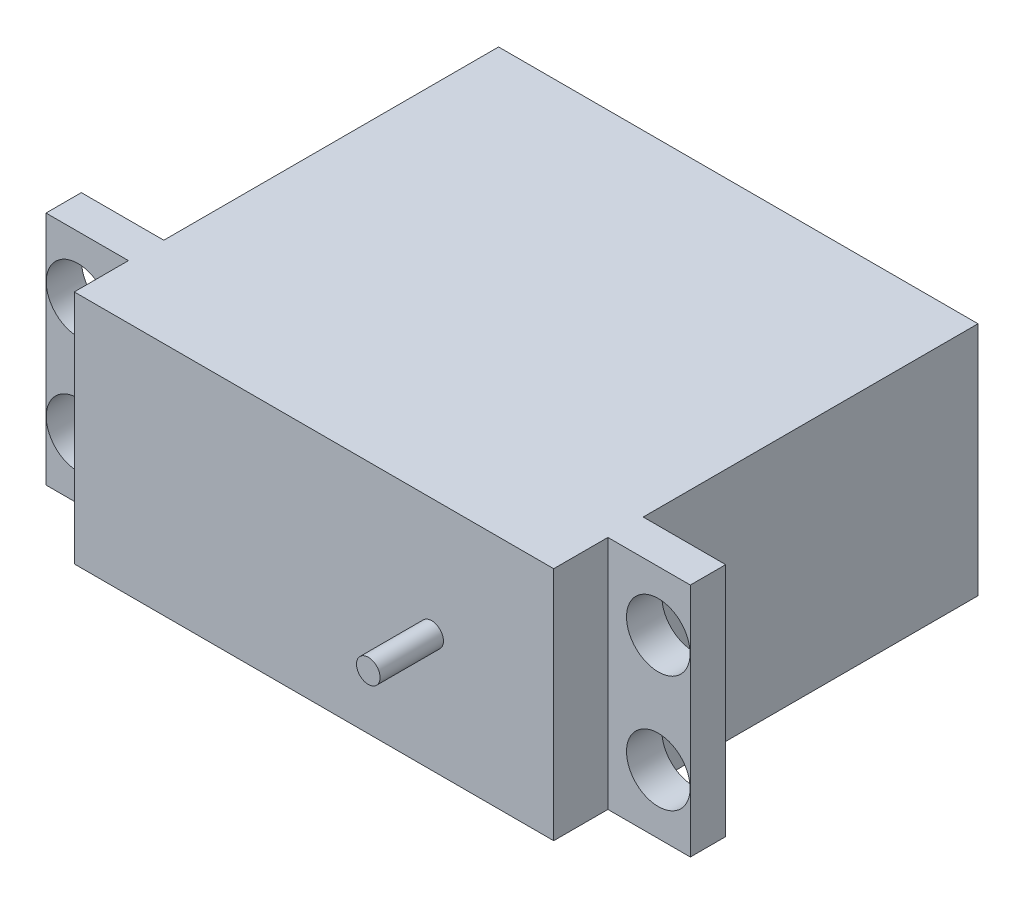
from build123d import *

# Parameters (mm, degrees)
SKETCH1_W           = 40.7
SKETCH1_H           = 20
BOSS_EXTRUDE1_DEPTH = 36.02
SKETCH3_R           = 1
BOSS_EXTRUDE2_DEPTH = 5.38
SKETCH4_W           = 3
SKETCH4_H           = 20
BOSS_EXTRUDE3_DEPTH = 7
SKETCH6_W           = 3
SKETCH6_H           = 20
BOSS_EXTRUDE4_DEPTH = 7
SKETCH7_R           = 2.7
CUT_EXTRUDE1_DEPTH  = 3


with BuildPart() as part:
    # Sketch1 → Boss-Extrude1 (new body)
    with BuildSketch(Plane.XY):
        with Locations((20.35, 10)):
            Rectangle(SKETCH1_W, SKETCH1_H)
    extrude(amount=BOSS_EXTRUDE1_DEPTH)

    # Sketch3 → Boss-Extrude2 (add)
    with BuildSketch(Plane.XY.offset(36.02)):
        with Locations(Location((30.34, 10, 0), (0, 0, 180))):
            Circle(SKETCH3_R)
    extrude(amount=BOSS_EXTRUDE2_DEPTH)

    # Sketch4 → Boss-Extrude3 (add)
    with BuildSketch(Plane(origin=(40.7, 0, 0), x_dir=(0, 0, -1), z_dir=(1, 0, 0))):
        with Locations((-29.92, 10)):
            Rectangle(SKETCH4_W, SKETCH4_H)
    extrude(amount=BOSS_EXTRUDE3_DEPTH)

    # Sketch6 → Boss-Extrude4 (add)
    with BuildSketch(Plane.ZY):
        with Locations((29.92, 10)):
            Rectangle(SKETCH6_W, SKETCH6_H)
    extrude(amount=BOSS_EXTRUDE4_DEPTH)

    # Sketch7 → Cut-Extrude1 (cut)
    with BuildSketch(Plane.XY.offset(31.42)):
        with Locations((-4.28, 14.95)):
            Circle(SKETCH7_R)
        with Locations((-4.28, 5.05)):
            Circle(SKETCH7_R)
        with Locations((44.98, 14.95)):
            Circle(SKETCH7_R)
        with Locations((44.98, 5.05)):
            Circle(SKETCH7_R)
    extrude(amount=-CUT_EXTRUDE1_DEPTH, mode=Mode.SUBTRACT)


solid = part.part
